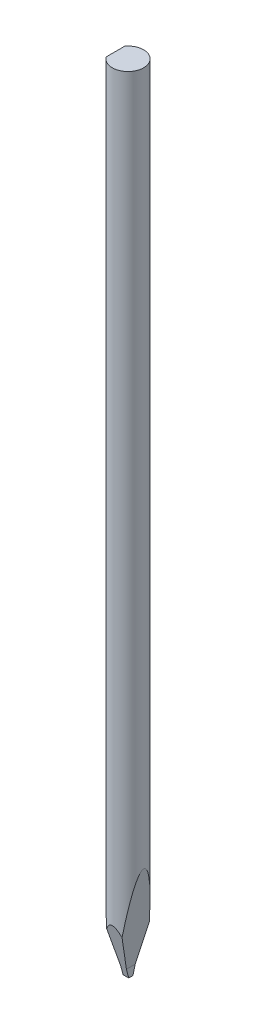
from build123d import *

# Parameters (mm, degrees)
SKETCH_TL_CUTTING_R    = 1.4986
TL_CUTTING_DEPTH       = 75.9968
SKETCH_TDF_CUTTING_W   = 3.01719996
SKETCH_TDF_CUTTING_H   = 3.01719996
TDF_CUTTING_DEPTH      = 77.026345527
VW_VR_GRINDING_DEPTH   = 1.50859998
VW_VR_GRINDING_2_DEPTH = 1.50859998
ISA_GRINDING_DEPTH     = 1.50859998
SKETCH_PRE_FRX_BRX_W   = 1.21682002
SKETCH_PRE_FRX_BRX_H   = 0.83312
SKETCH_PRE_FRX_BRX_W_2 = 1.24935996
PRE_FRX_BRX_DEPTH      = 1.50859998
FA_BA_GRINDING_DEPTH   = 1.50859998
ENGRAVING_DEPTH        = 0.005


with BuildPart() as part:
    # sketch_TL_cutting → TL_cutting (new body)
    with BuildSketch(Plane(origin=(0, 0, 0), x_dir=(1, 0, 0), z_dir=(0, 1, 0))):
        with Locations(Location((0, 0, 0), (0, 0, 270))):
            Circle(SKETCH_TL_CUTTING_R)
    extrude(amount=TL_CUTTING_DEPTH)

    # sketch_TDF_cutting → TDF_cutting (cut, through all)
    with BuildSketch(Plane(origin=(0, 0, 0), x_dir=(1, 0, 0), z_dir=(0, 1, 0))):
        with Locations((-2.71001998, 0)):
            Rectangle(SKETCH_TDF_CUTTING_W, SKETCH_TDF_CUTTING_H)
    extrude(amount=TDF_CUTTING_DEPTH, mode=Mode.SUBTRACT)


with BuildPart() as body_2:
    # sketch_VW_VR_grinding → VW_VR_grinding (new, symmetric)
    with BuildSketch(Plane(origin=(0, 0, 0), x_dir=(0, 0, -1), z_dir=(1, 0, 0))):
        with BuildLine():
            Line((-1.49360001, -0.00999998), (-1.49360001, 0.822008914))
            ThreePointArc((-1.49360001, 0.822008914), (-1.493648337, 0.823115792), (-1.493792952, 0.824214246))
            Line((-1.493792952, 0.824214246), (-1.51859996, 0.964901782))
            Line((-1.51859996, 0.964901782), (-1.50859998, -0.00999998))
            Line((-1.50859998, -0.00999998), (-1.49360001, -0.00999998))
        make_face()
    extrude(amount=VW_VR_GRINDING_DEPTH, both=True)


with BuildPart() as body_3:
    # sketch_VW_VR_grinding → VW_VR_grinding 2 (new, symmetric)
    with BuildSketch(Plane(origin=(0, 0, 0), x_dir=(0, 0, -1), z_dir=(1, 0, 0))):
        with BuildLine():
            Line((1.49360001, -0.00999998), (1.49360001, 0.822008914))
            ThreePointArc((1.49360001, 0.822008914), (1.493648337, 0.823115792), (1.493792952, 0.824214246))
            Line((1.493792952, 0.824214246), (1.51859996, 0.964901782))
            Line((1.51859996, 0.964901782), (1.50859998, -0.00999998))
            Line((1.50859998, -0.00999998), (1.49360001, -0.00999998))
        make_face()
    extrude(amount=VW_VR_GRINDING_2_DEPTH, both=True)


    add(body_2.part)  # ISA_grinding merges body 2
    # sketch_ISA_grinding → ISA_grinding (add, symmetric)
    with BuildSketch(Plane(origin=(0, 0, 0), x_dir=(0, 0, -1), z_dir=(1, 0, 0))):
        Polygon((-0.19939, 0), (0.19939, 0), (1.50859998, 4.886038163), (1.50859998, -0.02999994), (-1.50859998, -0.02999994), (-1.50859998, 4.886038163), align=None)
    extrude(amount=ISA_GRINDING_DEPTH, both=True)

    # sketch_pre_FRX_BRX → pre_FRX_BRX (add, symmetric)
    with BuildSketch(Plane.XY):
        with Locations((0.89018999, 0.40656002)):
            Rectangle(SKETCH_PRE_FRX_BRX_W, SKETCH_PRE_FRX_BRX_H)
        with Locations((-0.89391998, 0.40656002)):
            Rectangle(SKETCH_PRE_FRX_BRX_W_2, SKETCH_PRE_FRX_BRX_H)
    extrude(amount=PRE_FRX_BRX_DEPTH, both=True)

    # sketch_FA_BA_grinding → FA_BA_grinding (add, symmetric)
    with BuildSketch(Plane.XY):
        Polygon((0.27178, -0.00999998), (0.27178, 0.83312), (1.6256, 10.466049838), (1.6256, -0.00999998), align=None)
        Polygon((-0.26924, -0.00999998), (-0.26924, 0.83312), (-1.32842, 8.369577303), (-1.32842, -0.00999998), align=None)
    extrude(amount=FA_BA_GRINDING_DEPTH, both=True)


with BuildPart() as part_1:
    add(part.part)

    # B1_fix: cut body 3
    add(body_3.part, mode=Mode.SUBTRACT)

    # sketch_Engraving → Engraving (cut)
    # profile 1 of 9: a face of its own
    with BuildSketch(Plane.ZY.offset(1.20142)):
        Polygon((-1.243778574, 75.302998925), (-1.116218735, 75.429003156), (-0.926693853, 75.555785191), (-0.67598173, 75.683604298), (-0.359674813, 75.745569342), (-0.105332939, 75.745569342), (0.210973979, 75.683604298), (0.463500977, 75.555785191), (0.65302586, 75.429003156), (0.780585699, 75.302998925), (0.75880719, 75.28199822), (0.635654906, 75.406965379), (0.449500507, 75.531154734), (0.200343992, 75.654566286), (-0.10896269, 75.717568401), (-0.356045061, 75.717568401), (-0.665351744, 75.654566286), (-0.912693382, 75.531154734), (-1.098847782, 75.406965379), (-1.222000065, 75.28199822), align=None)
    # profile 2 of 9: a face of its own
    with BuildSketch(Plane.ZY.offset(1.20142)):
        Polygon((-1.044660777, 74.714149522), (-0.806912053, 74.714149522), (-0.747280421, 74.897711242), (-0.620498386, 75.029419368), (-0.598460609, 75.007122323), (-0.722909232, 74.883451503), (-0.777874041, 74.714149522), (-0.070331763, 74.714149522), (-0.052701542, 74.767817991), (0.010559842, 74.897451974), (0.077450977, 74.964343109), (0.208899835, 75.029419368), (0.344496981, 75.029419368), (0.477501447, 74.895637098), (0.539207223, 74.714149522), (0.780585699, 74.714149522), (0.780585699, 74.680963223), (0.544392582, 74.680963223), (0.544392582, 74.465252275), (0.780585699, 74.465252275), (0.780585699, 74.432065976), (0.539207223, 74.432065976), (0.477760715, 74.247726453), (0.35097868, 74.11679613), (0.328940903, 74.138056103), (0.453389527, 74.262763995), (0.508354335, 74.432065976), (-0.135667291, 74.432065976), (-0.153297512, 74.378397507), (-0.216558896, 74.247985721), (-0.283450031, 74.181094586), (-0.414898889, 74.11679613), (-0.614016686, 74.11679613), (-0.747021153, 74.249800596), (-0.806912053, 74.432065976), (-1.044660777, 74.432065976), (-1.044660777, 74.465252275), (-0.811838144, 74.465252275), (-0.811838144, 74.680963223), (-1.044660777, 74.680963223), align=None)
        Polygon((-0.777874041, 74.432065976), (-0.722390696, 74.26976423), (-0.602608896, 74.150760234), (-0.422936196, 74.150760234), (-0.30133952, 74.211947473), (-0.242226424, 74.271579105), (-0.178705773, 74.393175781), (-0.164705303, 74.435954995), align=None, mode=Mode.SUBTRACT)
        Polygon((-0.081739554, 74.680963223), (-0.778392576, 74.680963223), (-0.778392576, 74.465252275), (-0.155371656, 74.465252275), align=None, mode=Mode.SUBTRACT)
        Polygon((0.509132139, 74.680963223), (-0.05166447, 74.680963223), (-0.125037304, 74.465252275), (0.509132139, 74.465252275), align=None, mode=Mode.SUBTRACT)
        Polygon((-0.042071555, 74.714149522), (0.508354335, 74.710260503), (0.452870991, 74.880340288), (0.333089191, 74.99856648), (0.21590007, 74.99856648), (0.095340467, 74.938157044), (0.03622737, 74.87878468), (-0.027034013, 74.756928736), align=None, mode=Mode.SUBTRACT)
    # profile 3 of 9: a face of its own
    with BuildSketch(Plane.ZY.offset(1.20142)):
        Polygon((-0.124518768, 73.294605559), (-0.124518768, 73.782807137), (-0.785133544, 73.782807137), (-0.785133544, 72.981409857), (-0.81235668, 72.981409857), (-0.81235668, 73.810808078), (0.531688452, 73.810808078), (0.531688452, 72.981409857), (0.502909708, 72.981409857), (0.502909708, 73.782807137), (-0.095740024, 73.782807137), (-0.095740024, 73.294605559), align=None)
    # profile 4 of 9: a face of its own
    with BuildSketch(Plane.ZY.offset(1.20142)):
        Polygon((-0.79576353, 72.710682247), (0.085488284, 72.710682247), (0.085488284, 72.682681307), (-0.131519003, 72.682681307), (0.03622737, 72.517268345), (0.100266558, 72.387115827), (0.100266558, 72.191109245), (0.034412495, 72.057067707), (-0.138778506, 72.001065826), (0.03622737, 71.827874825), (0.100266558, 71.696685235), (0.100266558, 71.501456457), (0.034412495, 71.366637115), (-0.164186767, 71.302857196), (-0.79576353, 71.302857196), (-0.79576353, 71.330858136), (-0.17014993, 71.330858136), (0.009263502, 71.392045376), (0.068895134, 71.508456692), (0.068895134, 71.689685), (0.007448626, 71.8094668), (-0.173520413, 71.992250715), (-0.79576353, 71.992250715), (-0.79576353, 72.021288728), (-0.17014993, 72.021288728), (0.009263502, 72.081698163), (0.068895134, 72.198887284), (0.068895134, 72.37907852), (0.007448626, 72.499897391), (-0.173520413, 72.682681307), (-0.79576353, 72.682681307), align=None)
    # profile 5 of 9: a face of its own
    with BuildSketch(Plane.ZY.offset(1.20142)):
        Polygon((0.086525356, 70.902236336), (-0.067479816, 70.902236336), (0.036486638, 70.79982549), (0.100266558, 70.668635899), (0.100266558, 70.473666389), (0.036486638, 70.343254603), (-0.094702952, 70.21362062), (-0.287598318, 70.148803629), (-0.416973033, 70.148803629), (-0.610127667, 70.21362062), (-0.740280186, 70.343254603), (-0.803282301, 70.473666389), (-0.803282301, 70.668635899), (-0.740280186, 70.79982549), (-0.636313731, 70.902236336), (-1.227185424, 70.902236336), (-1.227185424, 70.930237276), (0.086525356, 70.930237276), align=None)
        Polygon((-0.110518298, 70.902236336), (-0.601571824, 70.902236336), (-0.72057582, 70.781676732), (-0.780985256, 70.661635664), (-0.780985256, 70.480666624), (-0.72057582, 70.360625556), (-0.599756948, 70.239028881), (-0.416973033, 70.177841641), (-0.295117089, 70.177841641), (-0.112333174, 70.239028881), (0.007448626, 70.360625556), (0.068895134, 70.480666624), (0.068895134, 70.661635664), (0.007448626, 70.781676732), align=None, mode=Mode.SUBTRACT)
    # profile 6 of 9: a face of its own
    with BuildSketch(Plane.ZY.offset(1.20142)):
        Polygon((-0.81235668, 69.439913158), (-0.81235668, 69.568510069), (-0.747798957, 69.703329411), (-0.551273839, 69.768146402), (0.062672703, 69.768146402), (0.062672703, 69.941337403), (0.090673643, 69.941337403), (0.090673643, 69.768146402), (0.515095302, 69.768146402), (0.515095302, 69.73910839), (0.090673643, 69.73910839), (0.090673643, 69.50213747), (0.062672703, 69.50213747), (0.062672703, 69.73910839), (-0.547644087, 69.73910839), (-0.726798251, 69.67792115), (-0.785392812, 69.561509834), (-0.785392812, 69.439913158), align=None)
    # profile 7 of 9: a face of its own
    with BuildSketch(Plane.ZY.offset(1.20142)):
        Polygon((-1.21499983, 69.352228732), (-1.21499983, 69.2925971), (-1.154071858, 69.1728153), (-1.033252986, 69.051218624), (-0.794985726, 68.929621949), (0.073302689, 69.302449283), (0.083673408, 69.277041022), (-0.759206747, 68.913028799), (0.083673408, 68.549016576), (0.073302689, 68.524386119), (-0.79835621, 68.900583937), (-1.051661012, 69.025810364), (-1.179480119, 69.155444347), (-1.243778574, 69.285596865), (-1.243778574, 69.352228732), align=None)
    # profile 8 of 9: a face of its own
    with BuildSketch(Plane.ZY.offset(1.20142)):
        Polygon((-1.044660777, 68.030428792), (-0.806912053, 68.030428792), (-0.747280421, 68.213990511), (-0.620498386, 68.345698637), (-0.598460609, 68.323401592), (-0.722909232, 68.199730773), (-0.777874041, 68.030428792), (-0.070331763, 68.030428792), (-0.052701542, 68.08409726), (0.010559842, 68.213731243), (0.077450977, 68.280622378), (0.208899835, 68.345698637), (0.344496981, 68.345698637), (0.477501447, 68.211916367), (0.539207223, 68.030428792), (0.780585699, 68.030428792), (0.780585699, 67.997242492), (0.544392582, 67.997242492), (0.544392582, 67.781531545), (0.780585699, 67.781531545), (0.780585699, 67.748345245), (0.539207223, 67.748345245), (0.477760715, 67.564005722), (0.35097868, 67.4330754), (0.328940903, 67.454335373), (0.453389527, 67.579043264), (0.508354335, 67.748345245), (-0.135667291, 67.748345245), (-0.153297512, 67.694676777), (-0.216558896, 67.56426499), (-0.283450031, 67.497373855), (-0.414898889, 67.4330754), (-0.614016686, 67.4330754), (-0.747021153, 67.566079866), (-0.806912053, 67.748345245), (-1.044660777, 67.748345245), (-1.044660777, 67.781531545), (-0.811838144, 67.781531545), (-0.811838144, 67.997242492), (-1.044660777, 67.997242492), align=None)
        Polygon((-0.777874041, 67.748345245), (-0.722390696, 67.586043499), (-0.602608896, 67.467039503), (-0.422936196, 67.467039503), (-0.30133952, 67.528226743), (-0.242226424, 67.587858375), (-0.178705773, 67.709455051), (-0.164705303, 67.752234265), align=None, mode=Mode.SUBTRACT)
        Polygon((-0.081739554, 67.997242492), (-0.778392576, 67.997242492), (-0.778392576, 67.781531545), (-0.155371656, 67.781531545), align=None, mode=Mode.SUBTRACT)
        Polygon((0.509132139, 67.997242492), (-0.05166447, 67.997242492), (-0.125037304, 67.781531545), (0.509132139, 67.781531545), align=None, mode=Mode.SUBTRACT)
        Polygon((-0.042071555, 68.030428792), (0.508354335, 68.026539772), (0.452870991, 68.196619557), (0.333089191, 68.314845749), (0.21590007, 68.314845749), (0.095340467, 68.254436314), (0.03622737, 68.19506395), (-0.027034013, 68.073208006), align=None, mode=Mode.SUBTRACT)
    # profile 9 of 9: a face of its own
    with BuildSketch(Plane.ZY.offset(1.20142)):
        Polygon((-1.222000065, 67.186718979), (-1.098847782, 67.061492552), (-0.912693382, 66.937303196), (-0.665351744, 66.813891645), (-0.356045061, 66.750889529), (-0.10896269, 66.750889529), (0.200343992, 66.813891645), (0.449500507, 66.937303196), (0.635654906, 67.061492552), (0.75880719, 67.186718979), (0.780585699, 67.164681202), (0.65302586, 67.039714043), (0.463500977, 66.91267274), (0.210973979, 66.785112901), (-0.105332939, 66.722110785), (-0.359674813, 66.722110785), (-0.67598173, 66.785112901), (-0.926693853, 66.91267274), (-1.116218735, 67.039714043), (-1.243778574, 67.164681202), align=None)
    extrude(amount=-ENGRAVING_DEPTH, mode=Mode.SUBTRACT)


solid = part_1.part
